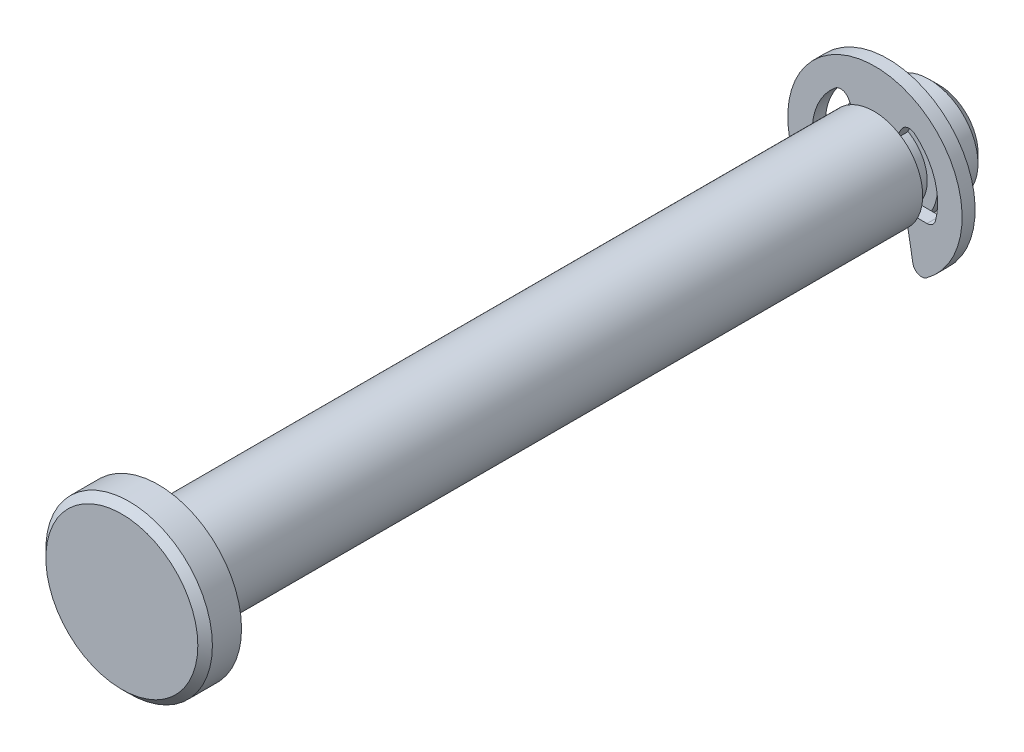
from build123d import *

# Parameters (mm, degrees)
SKETCH2_R      = 2.38125
EXTRUDE1_DEPTH = 19.05
SKETCH3_W      = 0.7366
SKETCH3_H      = 0.51435
SKETCH8_R      = 4.064
EXTRUDE6_DEPTH = 1.778
CHAMFER2_SIZE  = 0.3556
SKETCH4_R      = 4.2545
SKETCH4_R_2    = 1.8669
EXTRUDE2_DEPTH = 0.3175
EXTRUDE4_DEPTH = 22.679647702
EXTRUDE5_DEPTH = 0.635
FILLET1_R      = 0.42545
CHAMFER1_SIZE  = 0.47625


with BuildPart() as part:
    # Sketch2 → Extrude1 (new, symmetric)
    with BuildSketch(Plane.XY):
        with Locations(Location((0, 0, 0), (0, 0, 180))):
            Circle(SKETCH2_R)
    extrude(amount=EXTRUDE1_DEPTH, both=True)

    # Sketch3 → Cut-Revolve1 (revolve, cut)
    with BuildSketch(Plane(origin=(0, 0, 0), x_dir=(0, 0, -1), z_dir=(1, 0, 0)), mode=Mode.PRIVATE) as cut_revolve1_sk:
        with Locations((16.2433, 2.124075)):
            Rectangle(SKETCH3_W, SKETCH3_H)
    revolve(cut_revolve1_sk.sketch.rotate(Axis((0, 0, 19.05), (0, 0, -1)), 270), axis=Axis((0, 0, 19.05), (0, 0, -1)), mode=Mode.SUBTRACT)

    # Sketch8 → Extrude6 (add)
    with BuildSketch(Plane.XY.offset(19.05)):
        Circle(SKETCH8_R)
    extrude(amount=EXTRUDE6_DEPTH)

    # Chamfer2
    chamfer2_edges = [part.edges().sort_by_distance(p)[0] for p in [
        (-4.064, 0, 20.828),
    ]]
    chamfer(chamfer2_edges, length=CHAMFER2_SIZE)

    # Chamfer1
    chamfer1_edges = [part.edges().sort_by_distance(p)[0] for p in [
        (2.38125, 0, -19.05),
    ]]
    chamfer(chamfer1_edges, length=CHAMFER1_SIZE)


with BuildPart() as body_2:
    # Sketch4 → Extrude2 (new, symmetric)
    with BuildSketch(Plane.XY.offset(-16.2433)):
        Circle(SKETCH4_R)
        Circle(SKETCH4_R_2, mode=Mode.SUBTRACT)
    extrude(amount=EXTRUDE2_DEPTH, both=True)

    # Sketch5 → Extrude4 (cut, through all)
    with BuildSketch(Plane.XY):
        with BuildLine():
            Line((-1.53035, 2.650643953), (0, 0))
            Line((0, 0), (1.53035, 2.650643953))
            ThreePointArc((1.53035, 2.650643953), (2.889287878, 1.00990101), (2.84836284, -1.12014))
            Line((2.84836284, -1.12014), (1.49352, -1.12014))
            Line((1.49352, -1.12014), (1.96168838, -3.775254819))
            ThreePointArc((1.96168838, -3.775254819), (0, -4.2545), (-1.96168838, -3.775254819))
            Line((-1.96168838, -3.775254819), (-1.49352, -1.12014))
            Line((-1.49352, -1.12014), (-2.84836284, -1.12014))
            ThreePointArc((-2.84836284, -1.12014), (-2.889287878, 1.00990101), (-1.53035, 2.650643953))
        make_face()
    extrude(amount=-EXTRUDE4_DEPTH, mode=Mode.SUBTRACT)

    # Sketch6 → Extrude5 (add)
    with BuildSketch(Plane.XY.offset(-15.9258)):
        with BuildLine():
            Line((-0.93345, 1.616782826), (0.93345, 1.616782826))
            ThreePointArc((0.93345, 1.616782826), (0, 1.8669), (-0.93345, 1.616782826))
        make_face()
    extrude(amount=-EXTRUDE5_DEPTH)

    # Fillet1
    fillet1_edges = [body_2.edges().sort_by_distance(p)[0] for p in [
        (1.53035, 2.650643953, -16.2433),
        (1.96168838, -3.775254819, -16.2433),
        (-2.84836284, -1.12014, -16.2433),
        (2.84836284, -1.12014, -16.2433),
        (-1.96168838, -3.775254819, -16.2433),
        (-1.53035, 2.650643953, -16.2433),
    ]]
    fillet(fillet1_edges, radius=FILLET1_R)


solid = Compound([part.part, body_2.part])
